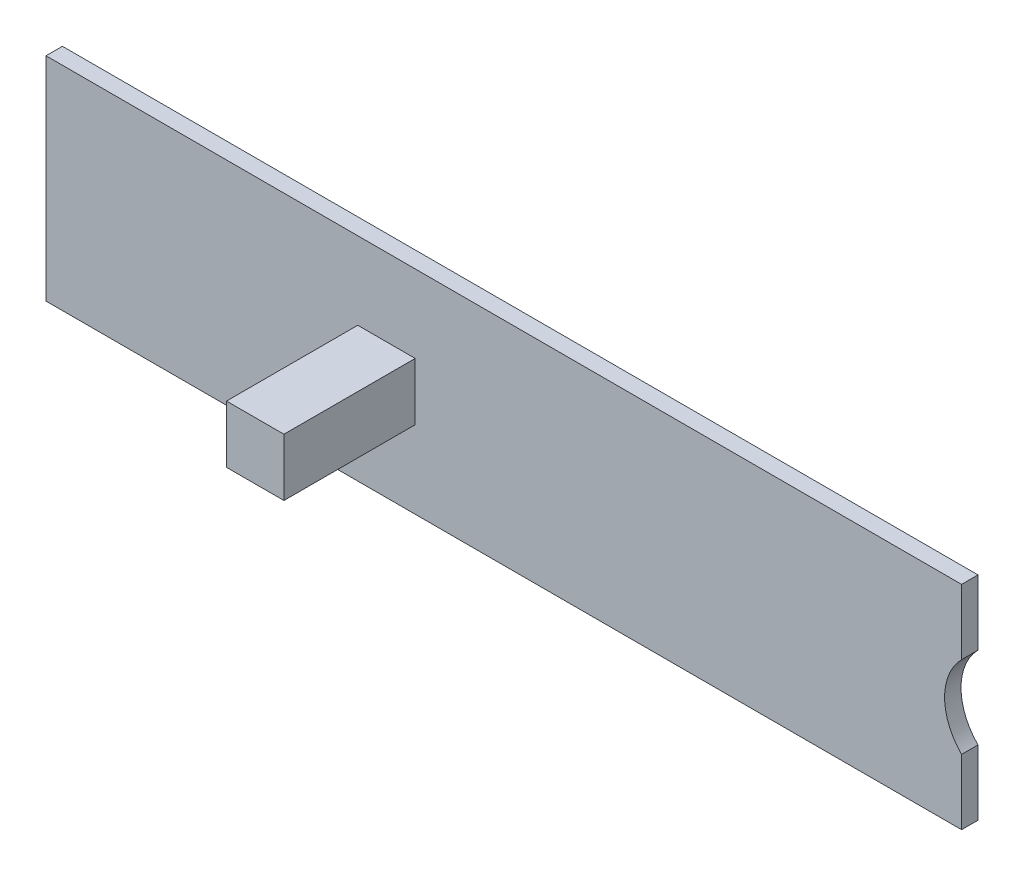
from build123d import *

# Parameters (mm, degrees)
ESQUISSE1_W             = 111.6
ESQUISSE1_H             = 25.9
BOSS_EXTRU_1_DEPTH      = 2
ESQUISSE2_W             = 7
ESQUISSE2_H             = 7
BOSS_EXTRU_2_DEPTH      = 16
ENL_V_MAT_EXTRU_1_DEPTH = 2


with BuildPart() as part:
    # Esquisse1 → Boss.-Extru.1 (new body)
    with BuildSketch(Plane.XY):
        with Locations((55.8, 12.95)):
            Rectangle(ESQUISSE1_W, ESQUISSE1_H)
    extrude(amount=BOSS_EXTRU_1_DEPTH)

    # Esquisse2 → Boss.-Extru.2 (add)
    with BuildSketch(Plane.XY.offset(2)):
        with Locations((41.5, 12.95)):
            Rectangle(ESQUISSE2_W, ESQUISSE2_H)
    extrude(amount=BOSS_EXTRU_2_DEPTH)

    # Esquisse3 → Enlèv. mat.-Extru.1 (cut)
    with BuildSketch(Plane(origin=(0, 0, 0), x_dir=(-1, 0, 0), z_dir=(0, 0, -1))):
        with BuildLine():
            Line((-111.6, 7.95), (-111.6, 17.95))
            ThreePointArc((-111.6, 17.95), (-109.528932188, 12.95), (-111.6, 7.95))
        make_face()
    extrude(amount=-ENL_V_MAT_EXTRU_1_DEPTH, mode=Mode.SUBTRACT)


solid = part.part
